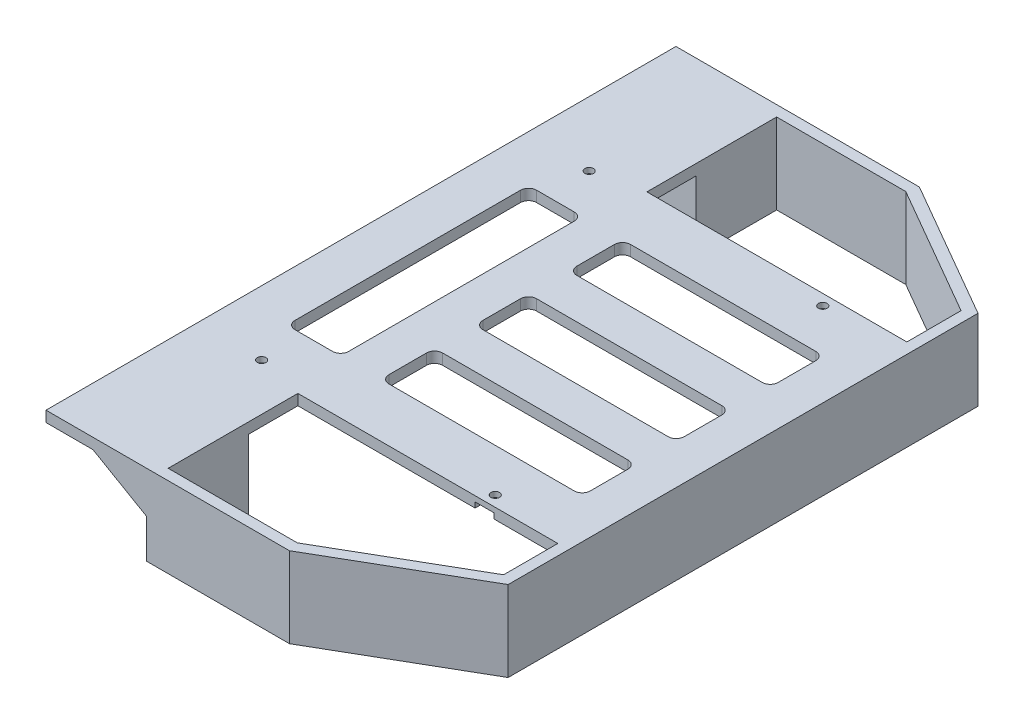
from build123d import *
from OCP.BRepFilletAPI import BRepFilletAPI_MakeChamfer

# Parameters (mm, degrees)
BOSS_EXTRUDE1_DEPTH = 30
CUT_EXTRUDE1_REACH  = 253.063
SKETCH10_W          = 41.5
SKETCH10_H          = 34
BOSS_EXTRUDE3_DEPTH = 4
CHAMFER4_SIZE       = 20
CHAMFER4_SIZE2      = 11.547005384
SKETCH11_W          = 20.75
SKETCH11_H          = 166.64
BOSS_EXTRUDE4_DEPTH = 4
SKETCH12_W          = 20.75
SKETCH12_H          = 18.32
BOSS_EXTRUDE5_DEPTH = 4
SKETCH13_W          = 75
SKETCH13_H          = 20
SKETCH13_W_2        = 20
SKETCH13_H_2        = 90
CUT_EXTRUDE2_DEPTH  = 4
FILLET1_R           = 3
CUT_EXTRUDE3_REACH  = 188.866
SKETCH15_R          = 1.6
CUT_EXTRUDE4_START  = -2
SKETCH16_R          = 3.5
SKETCH16_R_2        = 1.6
CUT_EXTRUDE4_DEPTH  = 2


with BuildPart() as part:
    # Sketch6 → Boss-Extrude1 (new body)
    with BuildSketch(Plane(origin=(0, 0, 0), x_dir=(1, 0, 0), z_dir=(0, 1, 0))):
        Polygon((0, -87.32), (37.5, -87.32), (37.5, -117.32), (90.67, -117.32), (142.319755082, -87.5), (142.319755082, 87.5), (90.67, 117.32), (37.5, 117.32), (37.5, 87.32), (0, 87.32), (0, 83.32), (41.5, 83.32), (41.5, 113.32), (89.59820323, 113.32), (138.319755082, 85.190598923), (138.319755082, -85.190598923), (89.59820323, -113.32), (41.5, -113.32), (41.5, -83.32), (0, -83.32), align=None)
    extrude(amount=BOSS_EXTRUDE1_DEPTH)

    # Sketch9 → Cut-Extrude1 (cut, up to next)
    with BuildSketch(Plane.XY.offset(87.32), mode=Mode.PRIVATE) as cut_extrude1_sk1:
        Polygon((37.5, 0), (15, 8), (0, 8), (0, 0), align=None)
    cut_extrude1_tool1 = extrude(cut_extrude1_sk1.sketch, amount=-CUT_EXTRUDE1_REACH, mode=Mode.PRIVATE) & part.part
    cut_extrude1 = cut_extrude1_tool1.solids().sort_by_distance((13.928571, 3.428571, 87.32))[0]
    add(cut_extrude1, mode=Mode.SUBTRACT)

    # Sketch10 → Boss-Extrude3 (add)
    with BuildSketch(Plane(origin=(0, 30, 0), x_dir=(1, 0, 0), z_dir=(0, 1, 0))):
        with Locations((20.75, -100.32)):
            Rectangle(SKETCH10_W, SKETCH10_H)
    boss_extrude3 = extrude(amount=-BOSS_EXTRUDE3_DEPTH)

    # Mirror1: Cut-Extrude1, Boss-Extrude3 across plane
    add(cut_extrude1.mirror(Plane.XY), mode=Mode.SUBTRACT)
    add(boss_extrude3.mirror(Plane.XY))

    # Chamfer4: one chamfer whose edges measure the first distance from different faces: ONE call of the kernel's chamfer builder (chamfer() names one face for all edges)
    chamfer4_edges_1 = [part.edges().sort_by_distance(p)[0] for p in [
        (37.5, 26, -102.32),
    ]]
    chamfer4_side_1 = [part.faces().sort_by_distance(p)[0] for p in [
        (18.75, 26, -102.32),
    ]]
    chamfer4_edges_2 = [part.edges().sort_by_distance(p)[0] for p in [
        (37.5, 26, 102.32),
    ]]
    chamfer4_side_2 = [part.faces().sort_by_distance(p)[0] for p in [
        (18.75, 26, 102.32),
    ]]
    chamfer4 = BRepFilletAPI_MakeChamfer(part.part.solid().wrapped)
    for e in chamfer4_edges_1:
        chamfer4.Add(CHAMFER4_SIZE, CHAMFER4_SIZE2, e.wrapped, chamfer4_side_1[0].wrapped)  # the first distance lies on this face
    for e in chamfer4_edges_2:
        chamfer4.Add(CHAMFER4_SIZE, CHAMFER4_SIZE2, e.wrapped, chamfer4_side_2[0].wrapped)  # the first distance lies on this face
    add(Compound.cast(chamfer4.Shape()), mode=Mode.REPLACE)

    # Sketch11 → Boss-Extrude4 (add)
    with BuildSketch(Plane(origin=(0, 30, 0), x_dir=(1, 0, 0), z_dir=(0, 1, 0))):
        with Locations((10.375, 0)):
            Rectangle(SKETCH11_W, SKETCH11_H)
    extrude(amount=-BOSS_EXTRUDE4_DEPTH)

    # Sketch12 → Boss-Extrude5 (add)
    with BuildSketch(Plane(origin=(0, 30, 0), x_dir=(1, 0, 0), z_dir=(0, 1, 0))):
        Polygon((41.5, 65), (20.75, 65), (20.75, -65), (41.5, -65), (138.319755082, -65), (138.319755082, 65), align=None)
        with Locations((31.125, -74.16)):
            Rectangle(SKETCH12_W, SKETCH12_H)
        with Locations((31.125, 74.16)):
            Rectangle(SKETCH12_W, SKETCH12_H)
    extrude(amount=-BOSS_EXTRUDE5_DEPTH)

    # Sketch13 → Cut-Extrude2 (cut)
    with BuildSketch(Plane(origin=(0, 30, 0), x_dir=(1, 0, 0), z_dir=(0, 1, 0))):
        with Locations((89.909877541, 35)):
            Rectangle(SKETCH13_W, SKETCH13_H)
        with Locations((89.909877541, 0)):
            Rectangle(SKETCH13_W, SKETCH13_H)
        with Locations((89.909877541, -35)):
            Rectangle(SKETCH13_W, SKETCH13_H)
        with Locations((27.409877541, 0)):
            Rectangle(SKETCH13_W_2, SKETCH13_H_2)
    extrude(amount=-CUT_EXTRUDE2_DEPTH, mode=Mode.SUBTRACT)

    # Fillet1
    fillet1_edges = [part.edges().sort_by_distance(p)[0] for p in [
        (37.409877541, 28, -45),
        (37.409877541, 28, 45),
        (17.409877541, 28, 45),
        (17.409877541, 28, -45),
        (52.409877541, 28, 45),
        (52.409877541, 28, 25),
        (127.409877541, 28, 25),
        (127.409877541, 28, 45),
        (52.409877541, 28, 10),
        (52.409877541, 28, -10),
        (127.409877541, 28, -10),
        (127.409877541, 28, 10),
        (52.409877541, 28, -25),
        (52.409877541, 28, -45),
        (127.409877541, 28, -45),
        (127.409877541, 28, -25),
    ]]
    fillet(fillet1_edges, radius=FILLET1_R)

    # Sketch15 → Cut-Extrude3 (cut, up to next)
    with BuildSketch(Plane(origin=(0, 30, 0), x_dir=(1, 0, 0), z_dir=(0, 1, 0)), mode=Mode.PRIVATE) as cut_extrude3_sk1:
        with Locations(Location((111, 61, 0), (0, 0, 270))):
            Circle(SKETCH15_R)
    cut_extrude3_tool1 = extrude(cut_extrude3_sk1.sketch, amount=-CUT_EXTRUDE3_REACH, mode=Mode.PRIVATE) & part.part
    # Sketch15 → Cut-Extrude3 (cut, up to next)
    with BuildSketch(Plane(origin=(0, 30, 0), x_dir=(1, 0, 0), z_dir=(0, 1, 0)), mode=Mode.PRIVATE) as cut_extrude3_sk2:
        with Locations(Location((111, -61, 0), (0, 0, 270))):
            Circle(SKETCH15_R)
    cut_extrude3_tool2 = extrude(cut_extrude3_sk2.sketch, amount=-CUT_EXTRUDE3_REACH, mode=Mode.PRIVATE) & part.part
    # Sketch15 → Cut-Extrude3 (cut, up to next)
    with BuildSketch(Plane(origin=(0, 30, 0), x_dir=(1, 0, 0), z_dir=(0, 1, 0)), mode=Mode.PRIVATE) as cut_extrude3_sk3:
        with Locations(Location((24, -61, 0), (0, 0, 270))):
            Circle(SKETCH15_R)
    cut_extrude3_tool3 = extrude(cut_extrude3_sk3.sketch, amount=-CUT_EXTRUDE3_REACH, mode=Mode.PRIVATE) & part.part
    # Sketch15 → Cut-Extrude3 (cut, up to next)
    with BuildSketch(Plane(origin=(0, 30, 0), x_dir=(1, 0, 0), z_dir=(0, 1, 0)), mode=Mode.PRIVATE) as cut_extrude3_sk4:
        with Locations(Location((24, 61, 0), (0, 0, 270))):
            Circle(SKETCH15_R)
    cut_extrude3_tool4 = extrude(cut_extrude3_sk4.sketch, amount=-CUT_EXTRUDE3_REACH, mode=Mode.PRIVATE) & part.part
    add(cut_extrude3_tool1.solids().sort_by_distance((111, 30, -61))[0], mode=Mode.SUBTRACT)
    add(cut_extrude3_tool2.solids().sort_by_distance((111, 30, 61))[0], mode=Mode.SUBTRACT)
    add(cut_extrude3_tool3.solids().sort_by_distance((24, 30, 61))[0], mode=Mode.SUBTRACT)
    add(cut_extrude3_tool4.solids().sort_by_distance((24, 30, -61))[0], mode=Mode.SUBTRACT)

    # Sketch16 → Cut-Extrude4 (cut)
    # profile 1 of 12: a face of its own
    with BuildSketch(Plane.XZ.offset(-26).offset(CUT_EXTRUDE4_START)):
        with Locations(Location((24, 61, 0), (0, 0, 270))):
            Circle(SKETCH16_R)
        with Locations(Location((24, 61, 0), (0, 0, 90))):
            Circle(SKETCH16_R_2, mode=Mode.SUBTRACT)
    # profile 2 of 12: a face of its own
    with BuildSketch(Plane.XZ.offset(-26).offset(CUT_EXTRUDE4_START)):
        with BuildLine():
            ThreePointArc((109.4, 61), (111, 62.6), (112.6, 61))
            Line((112.6, 61), (114.5, 61))
            ThreePointArc((114.5, 61), (111, 64.5), (107.5, 61))
            Line((107.5, 61), (109.4, 61))
        make_face()
    # profile 3 of 12: a face of its own
    with BuildSketch(Plane.XZ.offset(-26).offset(CUT_EXTRUDE4_START)):
        with BuildLine():
            Line((114.5, 61), (112.6, 61))
            ThreePointArc((112.6, 61), (111, 59.4), (109.4, 61))
            Line((109.4, 61), (107.5, 61))
            ThreePointArc((107.5, 61), (111, 57.5), (114.5, 61))
        make_face()
    # profile 4 of 12: a face of its own
    with BuildSketch(Plane.XZ.offset(-26).offset(CUT_EXTRUDE4_START)):
        with BuildLine():
            ThreePointArc((109.4, 61), (111, 62.6), (112.6, 61))
            Line((112.6, 61), (114.5, 61))
            ThreePointArc((114.5, 61), (111, 64.5), (107.5, 61))
            Line((107.5, 61), (109.4, 61))
        make_face()
    # profile 5 of 12: a face of its own
    with BuildSketch(Plane.XZ.offset(-26).offset(CUT_EXTRUDE4_START)):
        with BuildLine():
            Line((114.5, 61), (112.6, 61))
            ThreePointArc((112.6, 61), (111, 59.4), (109.4, 61))
            Line((109.4, 61), (107.5, 61))
            ThreePointArc((107.5, 61), (111, 57.5), (114.5, 61))
        make_face()
    # profile 6 of 12: a face of its own
    with BuildSketch(Plane.XZ.offset(-26).offset(CUT_EXTRUDE4_START)):
        with BuildLine():
            ThreePointArc((107.5, 61), (111, 64.5), (114.5, 61))
            Line((114.5, 61), (114.5, 65))
            Line((114.5, 65), (107.5, 65))
            Line((107.5, 65), (107.5, 61))
        make_face()
    # profile 7 of 12: a face of its own
    with BuildSketch(Plane.XZ.offset(-26).offset(CUT_EXTRUDE4_START)):
        with BuildLine():
            Line((114.5, -65), (114.5, -61))
            ThreePointArc((114.5, -61), (111, -64.5), (107.5, -61))
            Line((107.5, -61), (107.5, -65))
            Line((107.5, -65), (114.5, -65))
        make_face()
    # profile 8 of 12: a face of its own
    with BuildSketch(Plane.XZ.offset(-26).offset(CUT_EXTRUDE4_START)):
        with BuildLine():
            ThreePointArc((109.4, -61), (111, -59.4), (112.6, -61))
            Line((112.6, -61), (114.5, -61))
            ThreePointArc((114.5, -61), (111, -57.5), (107.5, -61))
            Line((107.5, -61), (109.4, -61))
        make_face()
    # profile 9 of 12: a face of its own
    with BuildSketch(Plane.XZ.offset(-26).offset(CUT_EXTRUDE4_START)):
        with BuildLine():
            Line((114.5, -61), (112.6, -61))
            ThreePointArc((112.6, -61), (111, -62.6), (109.4, -61))
            Line((109.4, -61), (107.5, -61))
            ThreePointArc((107.5, -61), (111, -64.5), (114.5, -61))
        make_face()
    # profile 10 of 12: a face of its own
    with BuildSketch(Plane.XZ.offset(-26).offset(CUT_EXTRUDE4_START)):
        with BuildLine():
            ThreePointArc((109.4, -61), (111, -59.4), (112.6, -61))
            Line((112.6, -61), (114.5, -61))
            ThreePointArc((114.5, -61), (111, -57.5), (107.5, -61))
            Line((107.5, -61), (109.4, -61))
        make_face()
    # profile 11 of 12: a face of its own
    with BuildSketch(Plane.XZ.offset(-26).offset(CUT_EXTRUDE4_START)):
        with BuildLine():
            Line((114.5, -61), (112.6, -61))
            ThreePointArc((112.6, -61), (111, -62.6), (109.4, -61))
            Line((109.4, -61), (107.5, -61))
            ThreePointArc((107.5, -61), (111, -64.5), (114.5, -61))
        make_face()
    # profile 12 of 12: a face of its own
    with BuildSketch(Plane.XZ.offset(-26).offset(CUT_EXTRUDE4_START)):
        with Locations(Location((24, -61, 0), (0, 0, 270))):
            Circle(SKETCH16_R)
        with Locations(Location((24, -61, 0), (0, 0, 90))):
            Circle(SKETCH16_R_2, mode=Mode.SUBTRACT)
    extrude(amount=CUT_EXTRUDE4_DEPTH, mode=Mode.SUBTRACT)


solid = part.part
